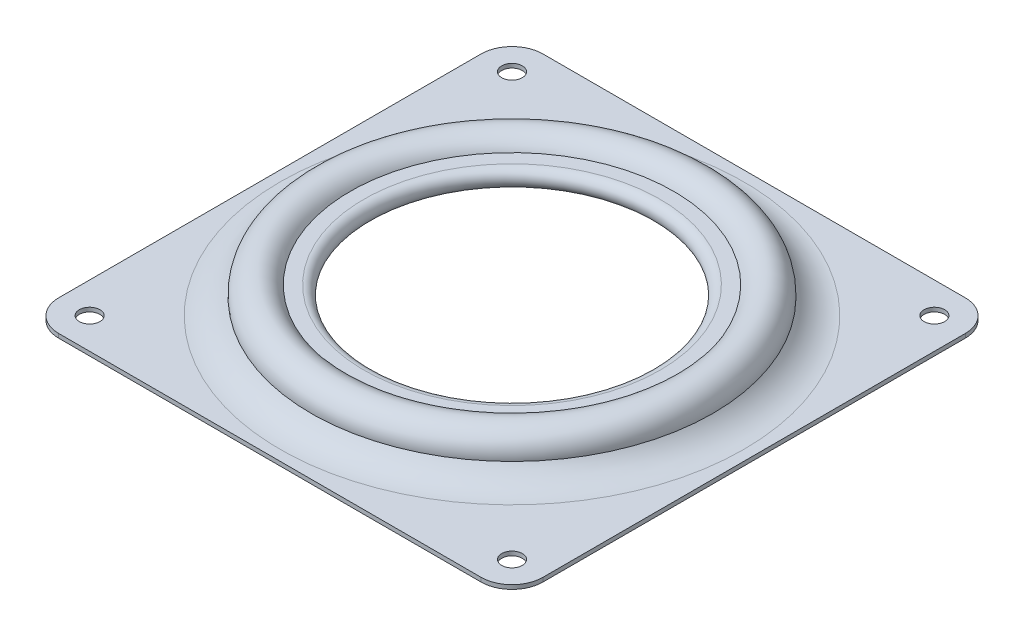
from build123d import *

# Parameters (mm, degrees)
ESQUISSE3_OUTSIDE_W     = 168.806
ESQUISSE3_OUTSIDE_H     = 168.806
ESQUISSE3_OUTSIDE_R     = 2
ENL_V_MAT_EXTRU_4_DEPTH = 10


with BuildPart() as part:
    # Esquisse2 → Révolution1 (revolve)
    with BuildSketch(Plane.XY, mode=Mode.PRIVATE) as r_volution1_sk:
        with BuildLine():
            Line((-65, 0), (-45, 0))
            ThreePointArc((-45, 0), (-41.436145743, 0.429518099), (-38.076390139, 1.693474289))
            ThreePointArc((-38.076390139, 1.693474289), (-34.520055524, 0.278897722), (-31.403126358, 2.5))
            Line((-31.403126358, 2.5), (-28.75, 2.5))
            ThreePointArc((-28.75, 2.5), (-27, 4.25), (-28.75, 6))
            Line((-28.75, 6), (-31.403126358, 6))
            ThreePointArc((-31.403126358, 6), (-36.101753129, 8.095275028), (-38.977854987, 3.829679045))
            ThreePointArc((-38.977854987, 3.829679045), (-41.629347775, 1.600096748), (-45, 0.8))
            Line((-45, 0.8), (-65, 0.8))
            Line((-65, 0.8), (-65, 0))
        make_face()
    revolve(r_volution1_sk.sketch.rotate(Axis((0, 0, 0), (0, 1, 0)), 180), axis=Axis((0, 0, 0), (0, 1, 0)))

    # Esquisse3 outside → Enlèv. mat.-Extru.4 (cut)
    # profile 1 of 5: a face of its own
    with BuildSketch(Plane(origin=(0, 0, 0), x_dir=(1, 0, 0), z_dir=(0, 1, 0))):
        Rectangle(ESQUISSE3_OUTSIDE_W, ESQUISSE3_OUTSIDE_H)
        with BuildLine():
            Line((-47, -41), (-47, 41))
            ThreePointArc((-47, 41), (-45.242640687, 45.242640687), (-41, 47))
            Line((-41, 47), (41, 47))
            ThreePointArc((41, 47), (45.242640687, 45.242640687), (47, 41))
            Line((47, 41), (47, -41))
            ThreePointArc((47, -41), (45.242640687, -45.242640687), (41, -47))
            Line((41, -47), (-41, -47))
            ThreePointArc((-41, -47), (-45.242640687, -45.242640687), (-47, -41))
        make_face(mode=Mode.SUBTRACT)
    # profile 2 of 5: a face of its own
    with BuildSketch(Plane(origin=(0, 0, 0), x_dir=(1, 0, 0), z_dir=(0, 1, 0))):
        with Locations((-41, 41)):
            Circle(ESQUISSE3_OUTSIDE_R)
    # profile 3 of 5: a face of its own
    with BuildSketch(Plane(origin=(0, 0, 0), x_dir=(1, 0, 0), z_dir=(0, 1, 0))):
        with Locations(Location((-41, -41, 0), (0, 0, 90))):
            Circle(ESQUISSE3_OUTSIDE_R)
    # profile 4 of 5: a face of its own
    with BuildSketch(Plane(origin=(0, 0, 0), x_dir=(1, 0, 0), z_dir=(0, 1, 0))):
        with Locations((41, -41)):
            Circle(ESQUISSE3_OUTSIDE_R)
    # profile 5 of 5: a face of its own
    with BuildSketch(Plane(origin=(0, 0, 0), x_dir=(1, 0, 0), z_dir=(0, 1, 0))):
        with Locations(Location((41, 41, 0), (0, 0, 90))):
            Circle(ESQUISSE3_OUTSIDE_R)
    extrude(amount=ENL_V_MAT_EXTRU_4_DEPTH, mode=Mode.SUBTRACT)


solid = part.part
